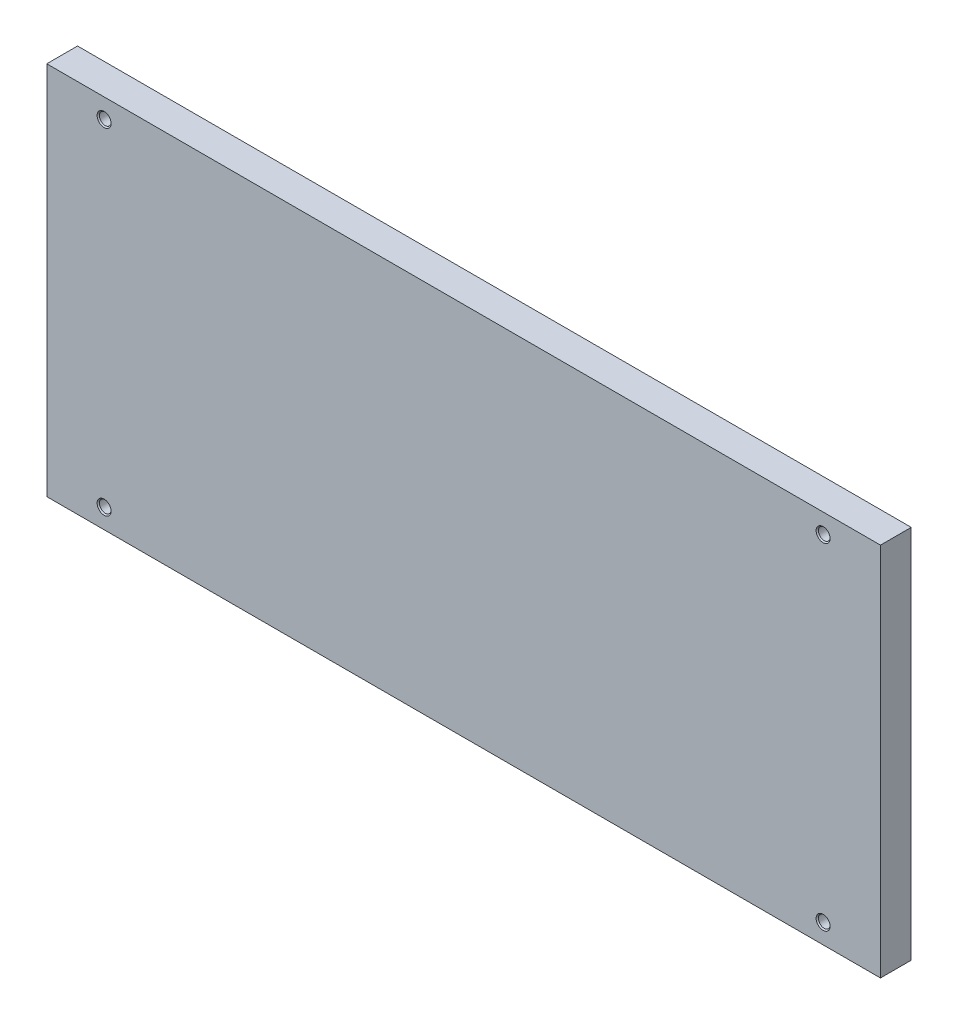
from build123d import *

# Parameters (mm, degrees)
SZKIC1_W                    = 596
SZKIC1_H                    = 268
DODANIE_WYCI_GNI_CIE1_DEPTH = 22


with BuildPart() as part:
    # Szkic1 → Dodanie-wyciągnięcie1 (new body)
    with BuildSketch(Plane.XY):
        Rectangle(SZKIC1_W, SZKIC1_H)
    extrude(amount=DODANIE_WYCI_GNI_CIE1_DEPTH)

    # Szkic2 → Wycięcie-obrót1 (revolve, cut)
    with BuildSketch(Plane(origin=(-257, 0, 0), x_dir=(0, 0, -1), z_dir=(1, 0, 0))):
        Polygon((-22, 120), (-22, 125), (-21.188, 124.188), (-0.812, 124.188), (0, 125), (0, 120), align=None)
    revolve(axis=Axis((-257, 120, 0), (0, 0, 1)), mode=Mode.SUBTRACT)

    # Szkic3 → Wycięcie-obrót2 (revolve, cut)
    with BuildSketch(Plane(origin=(-257, 0, 0), x_dir=(0, 0, -1), z_dir=(1, 0, 0))):
        Polygon((0, -120), (0, -125), (-0.812, -124.188), (-21.188, -124.188), (-22, -125), (-22, -120), align=None)
    revolve(axis=Axis((-257, -120, 22), (0, 0, -1)), mode=Mode.SUBTRACT)

    # Szkic4 → Wycięcie-obrót3 (revolve, cut)
    with BuildSketch(Plane(origin=(257, 0, 0), x_dir=(0, 0, -1), z_dir=(1, 0, 0))):
        Polygon((-22, 120), (-22, 125), (-21.188, 124.188), (-0.812, 124.188), (0, 125), (0, 120), align=None)
    revolve(axis=Axis((257, 120, 0), (0, 0, 1)), mode=Mode.SUBTRACT)

    # Szkic5 → Wycięcie-obrót4 (revolve, cut)
    with BuildSketch(Plane(origin=(257, 0, 0), x_dir=(0, 0, -1), z_dir=(1, 0, 0))):
        Polygon((0, -120), (0, -125), (-0.812, -124.188), (-21.188, -124.188), (-22, -125), (-22, -120), align=None)
    revolve(axis=Axis((257, -120, 22), (0, 0, -1)), mode=Mode.SUBTRACT)


solid = part.part
